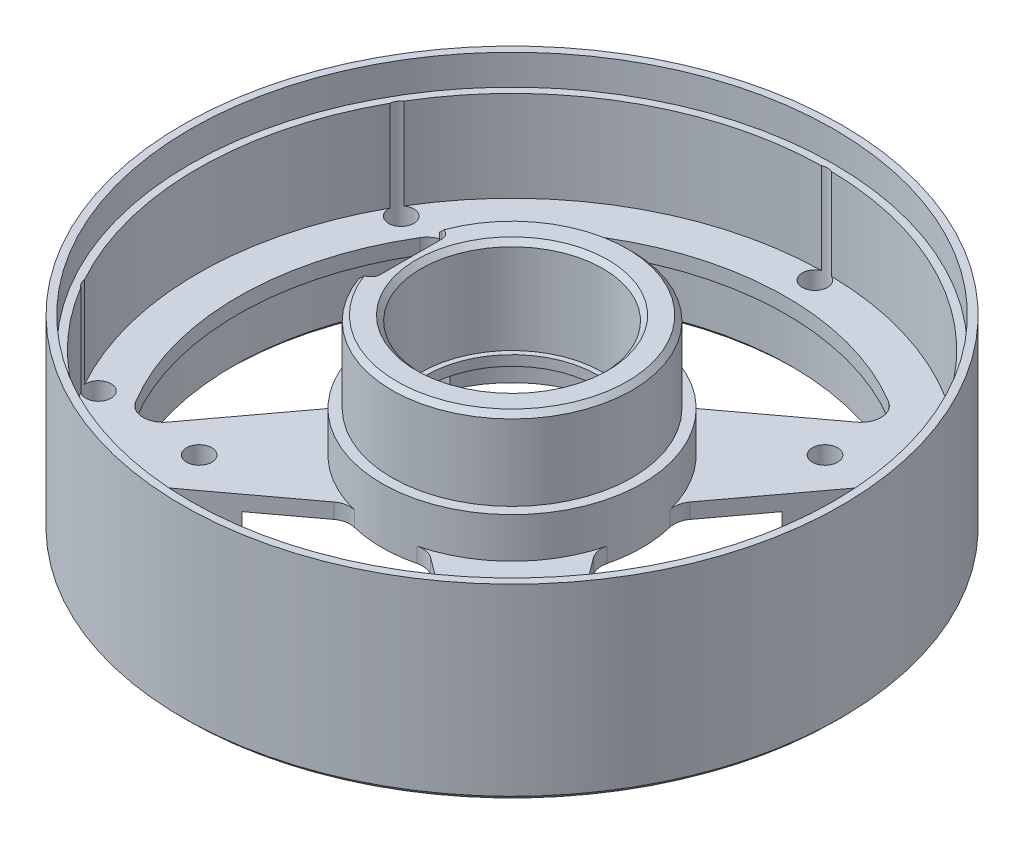
from build123d import *

# Parameters (mm, degrees)
M3X0_5_TAPPED_HOLE2_D   = 2.5
M3X0_5_TAPPED_HOLE3_D   = 2.5
CUT_EXTRUDE4_DEPTH      = 49.457559
CIRPATTERN3_COUNT       = 4
CIRPATTERN4_COUNT       = 6
CHAMFER1_SIZE           = 0.5
CUT_EXTRUDE6_DEPTH      = 49.457559
CUT_EXTRUDE6_DEPTH_BACK = 49.457559
CUT_EXTRUDE7_START      = -6.4
SKETCH18_W              = 13.80373
SKETCH18_H              = 8
CUT_EXTRUDE7_DEPTH      = 43.057559


with BuildPart() as part:
    # Sketch1 → Revolve1 (revolve)
    with BuildSketch(Plane.XY, mode=Mode.PRIVATE) as revolve1_sk:
        Polygon((-11.9, 4), (-11.9, -4), (-12.9, -4), (-12.9, -8), (-31.15, -8), (-31.15, 1), (-31.9, 1), (-31.9, 4), (-32.65, 4), (-32.65, -14.2), (-32.15, -14.7), (-27.65, -14.7), (-27.65, -9.5), (-24.5, -9.5), (-24.5, -12.5), (-19.5, -12.5), (-19.5, -9.5), (-10.9, -9.5), (-10.9, -6.4), (-8.5, -6.4), (-8.5, -5.4), (-9, -5.4), (-9, 4), align=None)
    revolve(revolve1_sk.sketch.rotate(Axis((0, 0, 0), (0, 1, 0)), 270), axis=Axis((0, 0, 0), (0, 1, 0)))

    # M3x0.5 Tapped Hole2 (through all)
    with Locations(Plane(origin=(0, -14.7, 0), x_dir=(-1, 0, 0), z_dir=(0, -1, 0))):
        with Locations((0, 30)):
            m3x0_5_tapped_hole2 = Hole(M3X0_5_TAPPED_HOLE2_D / 2)

    # M3x0.5 Tapped Hole3 (through all)
    with Locations(Plane(origin=(0, -12.5, 0), x_dir=(-1, 0, 0), z_dir=(0, -1, 0))):
        with Locations((-15.5, 15.5), (15.5, 15.5), (-15.5, -15.5), (15.5, -15.5)):
            Hole(M3X0_5_TAPPED_HOLE3_D / 2)

    # Sketch13 → Cut-Extrude4 (cut, through all)
    with BuildSketch(Plane(origin=(0, 0, 0), x_dir=(1, 0, 0), z_dir=(0, 1, 0))):
        with BuildLine():
            Line((14.252286, 19.889192), (4.79293, 12.853907))
            ThreePointArc((4.79293, 12.853907), (3.992298, 12.497696), (3.116234, 12.517951))
            ThreePointArc((3.116234, 12.517951), (0, 12.9), (-3.116234, 12.517951))
            ThreePointArc((-3.116234, 12.517951), (-3.992298, 12.497696), (-4.79293, 12.853907))
            Line((-4.79293, 12.853907), (-14.252286, 19.889192))
            ThreePointArc((-14.252286, 19.889192), (-15.056541, 21.587496), (-14.097195, 23.203267))
            ThreePointArc((-14.097195, 23.203267), (0, 27.15), (14.097195, 23.203267))
            ThreePointArc((14.097195, 23.203267), (15.056541, 21.587496), (14.252286, 19.889192))
        make_face()
    cut_extrude4 = extrude(amount=-CUT_EXTRUDE4_DEPTH, mode=Mode.SUBTRACT)

    # CirPattern3: Cut-Extrude4 ×4 about axis
    cirpattern3_axis = Axis((0, 0, 0), (0, 1, 0))
    for i in range(1, CIRPATTERN3_COUNT):
        add(cut_extrude4.rotate(cirpattern3_axis, i * 360 / CIRPATTERN3_COUNT), mode=Mode.SUBTRACT)

    # CirPattern4: M3x0.5 Tapped Hole2 ×6 about axis
    cirpattern4_axis = Axis((0, 0, 0), (0, 1, 0))
    for i in range(1, CIRPATTERN4_COUNT):
        add(m3x0_5_tapped_hole2.rotate(cirpattern4_axis, i * 360 / CIRPATTERN4_COUNT), mode=Mode.SUBTRACT)

    # Chamfer1
    chamfer1_edges = [part.edges().sort_by_distance(p)[0] for p in [
        (0, 4, 11.9),
        (0, -14.7, 27.65),
        (0, 4, 9),
    ]]
    chamfer(chamfer1_edges, length=CHAMFER1_SIZE)

    # Sketch16 → Cut-Extrude6 (cut, two sides: drawn at the far end of the back side and taken through both)
    with BuildSketch(Plane(origin=(0, 0, 0), x_dir=(1, 0, 0), z_dir=(0, 1, 0)).offset(-CUT_EXTRUDE6_DEPTH_BACK)):
        with BuildLine():
            Line((-18.769737, 4), (-11, 4))
            ThreePointArc((-11, 4), (-10.292893, 3.707107), (-10, 3))
            Line((-10, 3), (-10, -3))
            ThreePointArc((-10, -3), (-10.292893, -3.707107), (-11, -4))
            Line((-11, -4), (-18.769737, -4))
            ThreePointArc((-18.769737, -4), (-19.476844, -3.707107), (-19.769737, -3))
            Line((-19.769737, -3), (-19.769737, 3))
            ThreePointArc((-19.769737, 3), (-19.476844, 3.707107), (-18.769737, 4))
        make_face()
    extrude(amount=CUT_EXTRUDE6_DEPTH + CUT_EXTRUDE6_DEPTH_BACK, mode=Mode.SUBTRACT)

    # Sketch18 → Cut-Extrude7 (cut, through all)
    with BuildSketch(Plane(origin=(0, 0, 0), x_dir=(1, 0, 0), z_dir=(0, 1, 0)).offset(CUT_EXTRUDE7_START)):
        with Locations((-11.236069, 0)):
            Rectangle(SKETCH18_W, SKETCH18_H)
    extrude(amount=-CUT_EXTRUDE7_DEPTH, mode=Mode.SUBTRACT)


solid = part.part
